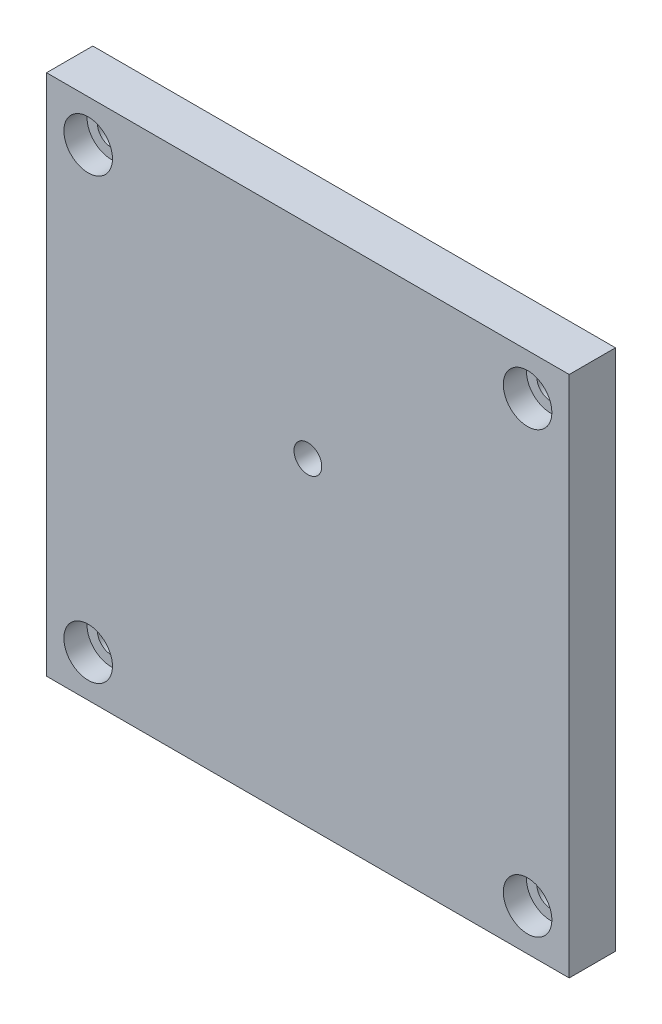
from build123d import *

# Parameters (mm, degrees)
SKETCH1_W           = 57.404
SKETCH1_H           = 57.404
SKETCH1_R           = 1.524
BOSS_EXTRUDE1_DEPTH = 5.08
SKETCH2_R           = 2.667
CUT_EXTRUDE1_DEPTH  = 2.54
SKETCH3_R           = 1.524
CUT_EXTRUDE2_DEPTH  = 41.90740774


with BuildPart() as part:
    # Sketch1 → Boss-Extrude1 (new body)
    with BuildSketch(Plane.XY):
        Rectangle(SKETCH1_W, SKETCH1_H)
        with Locations(Location((-24.13, 24.13, 0), (0, 0, 180))):
            Circle(SKETCH1_R, mode=Mode.SUBTRACT)
        with Locations(Location((-24.13, -24.13, 0), (0, 0, 180))):
            Circle(SKETCH1_R, mode=Mode.SUBTRACT)
        with Locations(Location((24.13, -24.13, 0), (0, 0, 180))):
            Circle(SKETCH1_R, mode=Mode.SUBTRACT)
        with Locations(Location((24.13, 24.13, 0), (0, 0, 180))):
            Circle(SKETCH1_R, mode=Mode.SUBTRACT)
    extrude(amount=BOSS_EXTRUDE1_DEPTH)

    # Sketch2 → Cut-Extrude1 (cut)
    with BuildSketch(Plane.XY.offset(5.08)):
        with Locations((-24.13, -24.13)):
            Circle(SKETCH2_R)
        with Locations((-24.13, 24.13)):
            Circle(SKETCH2_R)
        with Locations((24.13, 24.13)):
            Circle(SKETCH2_R)
        with Locations((24.13, -24.13)):
            Circle(SKETCH2_R)
    extrude(amount=-CUT_EXTRUDE1_DEPTH, mode=Mode.SUBTRACT)

    # Sketch3 → Cut-Extrude2 (cut, through all)
    with BuildSketch(Plane.XY.offset(5.08)):
        with Locations((0, 6.35)):
            Circle(SKETCH3_R)
    extrude(amount=-CUT_EXTRUDE2_DEPTH, mode=Mode.SUBTRACT)


solid = part.part
